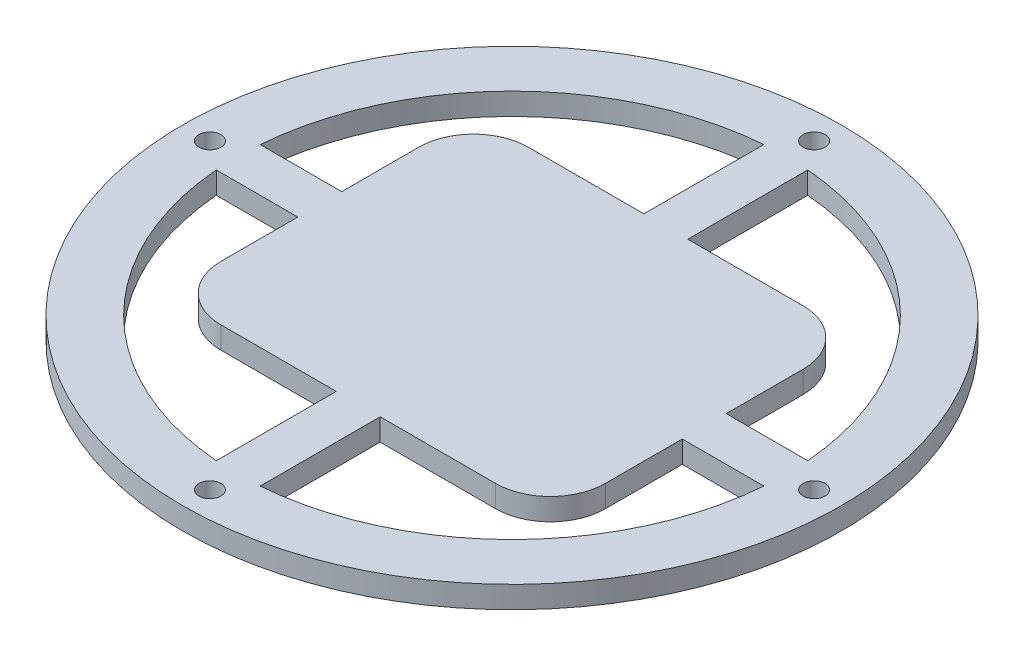
from build123d import *

# Parameters (mm, degrees)
SKETCH1_R           = 30
SKETCH1_R_2         = 25
BOSS_EXTRUDE1_DEPTH = 2
SKETCH2_R           = 1
CUT_EXTRUDE1_DEPTH  = 2
BOSS_EXTRUDE2_DEPTH = 2
FILLET1_R           = 5


with BuildPart() as part:
    # Sketch1 → Boss-Extrude1 (new body)
    with BuildSketch(Plane(origin=(0, 0, 0), x_dir=(1, 0, 0), z_dir=(0, 1, 0))):
        with Locations(Location((0, 0, 0), (0, 0, 270))):
            Circle(SKETCH1_R)
        with Locations(Location((0, 0, 0), (0, 0, 270))):
            Circle(SKETCH1_R_2, mode=Mode.SUBTRACT)
    extrude(amount=BOSS_EXTRUDE1_DEPTH)

    # Sketch2 → Cut-Extrude1 (cut)
    with BuildSketch(Plane(origin=(0, 2, 0), x_dir=(1, 0, 0), z_dir=(0, 1, 0))):
        with Locations(Location((0, 27.5, 0), (0, 0, 270))):
            Circle(SKETCH2_R)
        with Locations(Location((27.5, 0, 0), (0, 0, 270))):
            Circle(SKETCH2_R)
        with Locations(Location((0, -27.5, 0), (0, 0, 270))):
            Circle(SKETCH2_R)
        with Locations(Location((-27.5, 0, 0), (0, 0, 270))):
            Circle(SKETCH2_R)
    extrude(amount=-CUT_EXTRUDE1_DEPTH, mode=Mode.SUBTRACT)

    # Sketch3 → Boss-Extrude2 (add)
    with BuildSketch(Plane(origin=(0, 0, 0), x_dir=(1, 0, 0), z_dir=(0, 1, 0))):
        with BuildLine():
            Line((17.5, 14), (2, 14))
            Line((2, 14), (2, 24.919871589))
            ThreePointArc((2, 24.919871589), (0, 25), (-2, 24.919871589))
            Line((-2, 24.919871589), (-2, 14))
            Line((-2, 14), (-17.5, 14))
            Line((-17.5, 14), (-17.5, 2))
            Line((-17.5, 2), (-24.919871589, 2))
            ThreePointArc((-24.919871589, 2), (-25, 0), (-24.919871589, -2))
            Line((-24.919871589, -2), (-17.5, -2))
            Line((-17.5, -2), (-17.5, -14))
            Line((-17.5, -14), (-2, -14))
            Line((-2, -14), (-2, -24.919871589))
            ThreePointArc((-2, -24.919871589), (0, -25), (2, -24.919871589))
            Line((2, -24.919871589), (2, -14))
            Line((2, -14), (17.5, -14))
            Line((17.5, -14), (17.5, -2))
            Line((17.5, -2), (24.919871589, -2))
            ThreePointArc((24.919871589, -2), (25, 0), (24.919871589, 2))
            Line((24.919871589, 2), (17.5, 2))
            Line((17.5, 2), (17.5, 14))
        make_face()
    extrude(amount=BOSS_EXTRUDE2_DEPTH)

    # Fillet1
    fillet1_edges = [part.edges().sort_by_distance(p)[0] for p in [
        (-17.5, 1, 14),
        (17.5, 1, 14),
        (17.5, 1, -14),
        (-17.5, 1, -14),
    ]]
    fillet(fillet1_edges, radius=FILLET1_R)


solid = part.part
